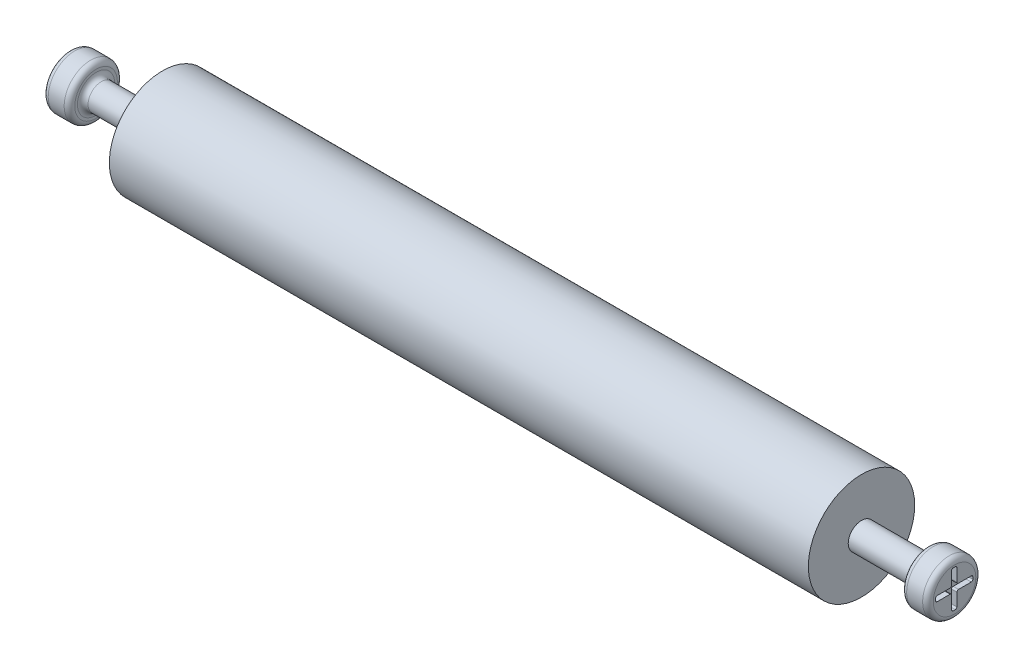
from build123d import *

# Parameters (mm, degrees)
BOSS_EXTRUDE1_DEPTH      = 167.005
BOSS_EXTRUDE1_DEPTH_BACK = 167.005
SKETCH1_R                = 25.4
SKETCH2_R                = 6.35
BOSS_EXTRUDE2_DEPTH      = 31.75
SKETCH3_R                = 12.7
BOSS_EXTRUDE3_DEPTH      = 12.7
FILLET2_R                = 2.54
CUT_EXTRUDE1_DEPTH       = 2.54
FILLET2_OF_MIRROR1_R     = 2.54


with BuildPart() as part:
    # Sketch1 → Boss-Extrude1 (new, two sides: drawn at the far end of the back side and taken through both)
    with BuildSketch(Plane(origin=(0, 0, 0), x_dir=(0, 0, -1), z_dir=(1, 0, 0)).offset(-BOSS_EXTRUDE1_DEPTH_BACK)):
        Circle(SKETCH1_R)
    extrude(amount=BOSS_EXTRUDE1_DEPTH + BOSS_EXTRUDE1_DEPTH_BACK)

    # Sketch2 → Boss-Extrude2 (add)
    with BuildSketch(Plane.ZY.offset(167.005)):
        Circle(SKETCH2_R)
    boss_extrude2 = extrude(amount=BOSS_EXTRUDE2_DEPTH)

    # Sketch3 → Boss-Extrude3 (add)
    with BuildSketch(Plane.ZY.offset(198.755)):
        Circle(SKETCH3_R)
    boss_extrude3 = extrude(amount=BOSS_EXTRUDE3_DEPTH)

    # Fillet2
    fillet2_edges = [part.edges().sort_by_distance(p)[0] for p in [
        (-198.755, 0, -6.35),
        (-198.755, 0, -12.7),
        (-211.455, 0, -12.7),
    ]]
    fillet(fillet2_edges, radius=FILLET2_R)

    # Sketch4 → Cut-Extrude1 (cut)
    with BuildSketch(Plane.ZY.offset(211.455)):
        with BuildLine():
            Line((-0.359749232, 9.260626921), (0.656250768, 9.260626921))
            ThreePointArc((0.656250768, 9.260626921), (1.195066136, 9.037442288), (1.418250768, 8.498626921))
            Line((1.418250768, 8.498626921), (1.418250768, 2.402626921))
            ThreePointArc((1.418250768, 2.402626921), (1.641435401, 1.863811554), (2.180250768, 1.640626921))
            Line((2.180250768, 1.640626921), (8.276250768, 1.640626921))
            ThreePointArc((8.276250768, 1.640626921), (8.815066136, 1.417442288), (9.038250768, 0.878626921))
            Line((9.038250768, 0.878626921), (9.038250768, -0.137373079))
            ThreePointArc((9.038250768, -0.137373079), (8.815066136, -0.676188446), (8.276250768, -0.899373079))
            Line((8.276250768, -0.899373079), (2.180250768, -0.899373079))
            ThreePointArc((2.180250768, -0.899373079), (1.641435401, -1.122557712), (1.418250768, -1.661373079))
            Line((1.418250768, -1.661373079), (1.418250768, -7.757373079))
            ThreePointArc((1.418250768, -7.757373079), (1.195066136, -8.296188446), (0.656250768, -8.519373079))
            Line((0.656250768, -8.519373079), (-0.359749232, -8.519373079))
            ThreePointArc((-0.359749232, -8.519373079), (-0.898564599, -8.296188446), (-1.121749232, -7.757373079))
            Line((-1.121749232, -7.757373079), (-1.121749232, -1.661373079))
            ThreePointArc((-1.121749232, -1.661373079), (-1.344933864, -1.122557712), (-1.883749232, -0.899373079))
            Line((-1.883749232, -0.899373079), (-7.979749232, -0.899373079))
            ThreePointArc((-7.979749232, -0.899373079), (-8.518564599, -0.676188446), (-8.741749232, -0.137373079))
            Line((-8.741749232, -0.137373079), (-8.741749232, 0.878626921))
            ThreePointArc((-8.741749232, 0.878626921), (-8.518564599, 1.417442288), (-7.979749232, 1.640626921))
            Line((-7.979749232, 1.640626921), (-1.883749232, 1.640626921))
            ThreePointArc((-1.883749232, 1.640626921), (-1.344933864, 1.863811554), (-1.121749232, 2.402626921))
            Line((-1.121749232, 2.402626921), (-1.121749232, 8.498626921))
            ThreePointArc((-1.121749232, 8.498626921), (-0.898564599, 9.037442288), (-0.359749232, 9.260626921))
        make_face()
    cut_extrude1 = extrude(amount=-CUT_EXTRUDE1_DEPTH, mode=Mode.SUBTRACT)

    # Mirror1: Boss-Extrude2, Boss-Extrude3, Cut-Extrude1 across plane
    add(boss_extrude2.mirror(Plane(origin=(0, 0, 0), x_dir=(0, 0, 1), z_dir=(1, 0, 0))))
    add(boss_extrude3.mirror(Plane(origin=(0, 0, 0), x_dir=(0, 0, 1), z_dir=(1, 0, 0))))
    add(cut_extrude1.mirror(Plane(origin=(0, 0, 0), x_dir=(0, 0, 1), z_dir=(1, 0, 0))), mode=Mode.SUBTRACT)

    # Fillet2 of Mirror1
    fillet2_of_mirror1_edges = [part.edges().sort_by_distance(p)[0] for p in [
        (198.755, 0, -6.35),
        (198.755, 0, -12.7),
        (211.455, 0, -12.7),
    ]]
    fillet(fillet2_of_mirror1_edges, radius=FILLET2_OF_MIRROR1_R)


solid = part.part
